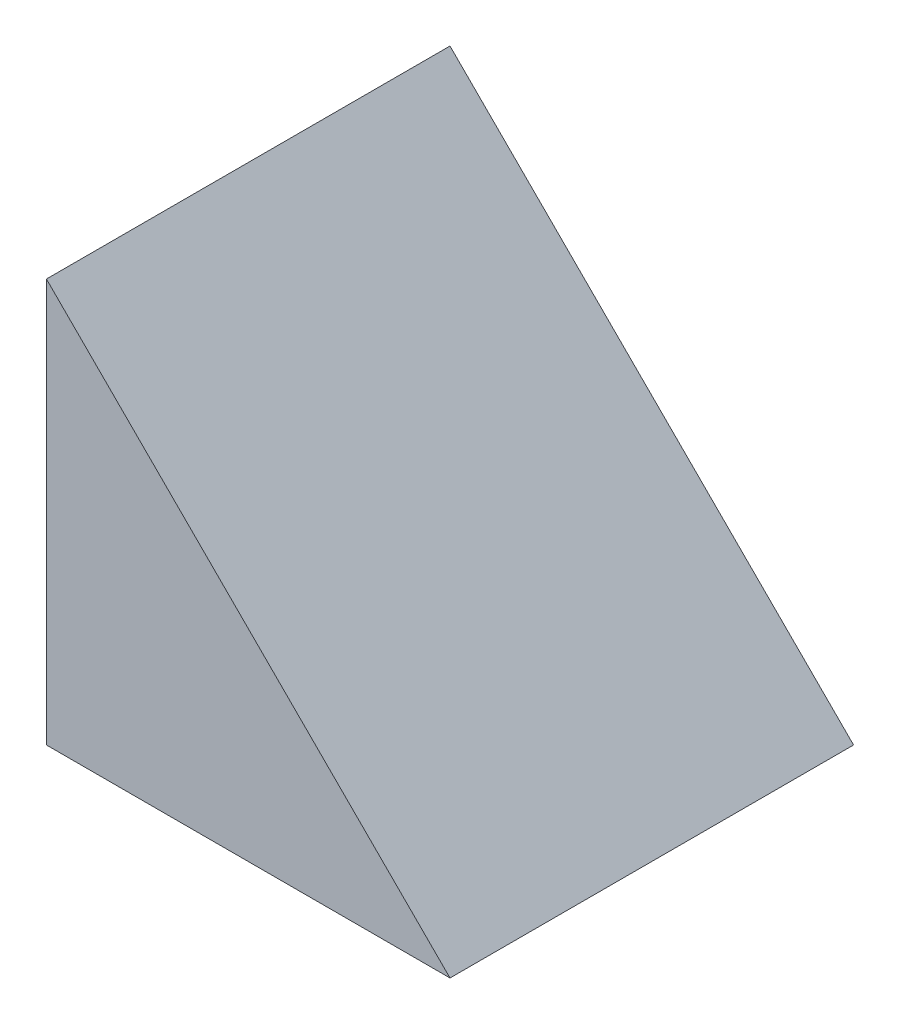
from build123d import *

# Parameters (mm, degrees)
RESSALTO_EXTRUS_O1_DEPTH = 15


with BuildPart() as part:
    # Esboço1 → Ressalto-extrusão1 (new body)
    with BuildSketch(Plane.XY):
        Polygon((0, 0), (0, 15), (15, 0), align=None)
    extrude(amount=RESSALTO_EXTRUS_O1_DEPTH)


solid = part.part
